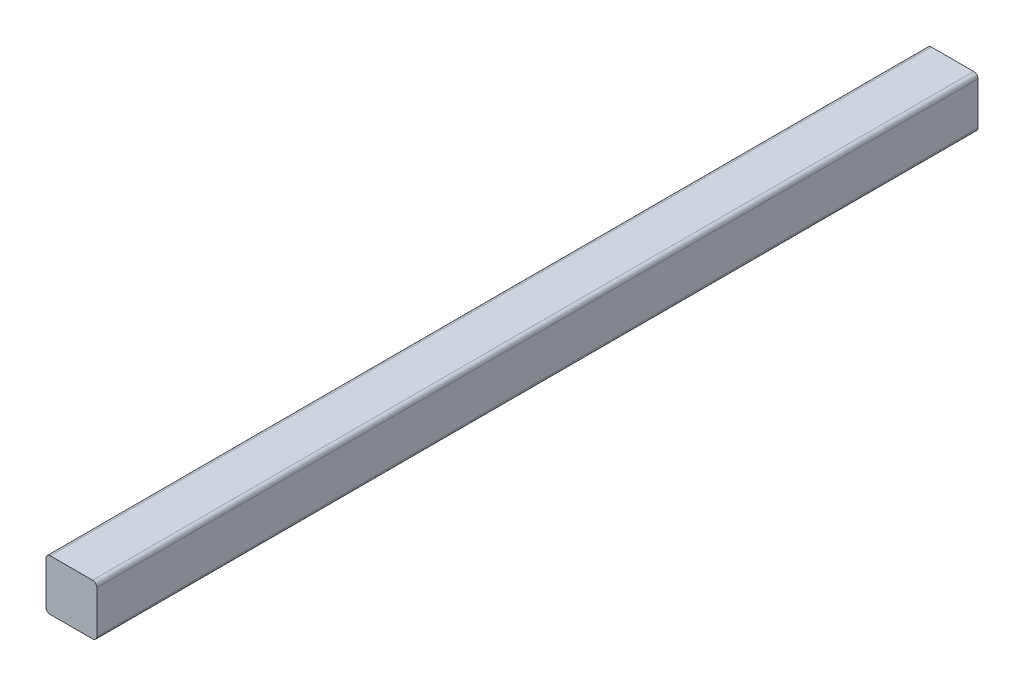
from build123d import *

# Parameters (mm, degrees)
SKETCH1_W           = 38.1
SKETCH1_H           = 38.1
BOSS_EXTRUDE1_DEPTH = 660.4
FILLET1_R           = 3.175


with BuildPart() as part:
    # Sketch1 → Boss-Extrude1 (new body)
    with BuildSketch(Plane.XY):
        Rectangle(SKETCH1_W, SKETCH1_H)
    extrude(amount=BOSS_EXTRUDE1_DEPTH)

    # Fillet1
    fillet1_edges = [part.edges().sort_by_distance(p)[0] for p in [
        (19.05, -19.05, 330.2),
        (-19.05, -19.05, 330.2),
        (-19.05, 19.05, 330.2),
        (19.05, 19.05, 330.2),
    ]]
    fillet(fillet1_edges, radius=FILLET1_R)


solid = part.part
